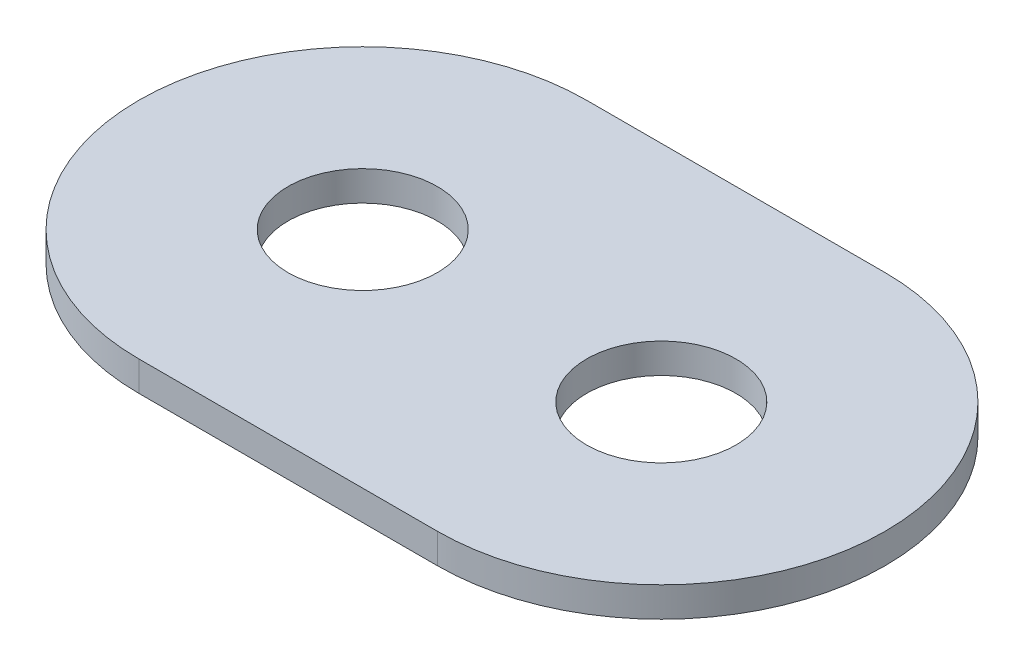
from build123d import *

# Parameters (mm, degrees)
SKETCH1_R           = 5
BOSS_EXTRUDE1_DEPTH = 2


with BuildPart() as part:
    # Sketch1 → Boss-Extrude1 (new body)
    with BuildSketch(Plane(origin=(0, 0, 0), x_dir=(1, 0, 0), z_dir=(0, 1, 0))):
        with BuildLine():
            Line((-10, 15), (10, 15))
            ThreePointArc((10, 15), (25, 0), (10, -15))
            Line((10, -15), (-10, -15))
            ThreePointArc((-10, -15), (-25, 0), (-10, 15))
        make_face()
        with Locations(Location((10, 0, 0), (0, 0, 270))):
            Circle(SKETCH1_R, mode=Mode.SUBTRACT)
        with Locations(Location((-10, 0, 0), (0, 0, 270))):
            Circle(SKETCH1_R, mode=Mode.SUBTRACT)
    extrude(amount=BOSS_EXTRUDE1_DEPTH)


solid = part.part
